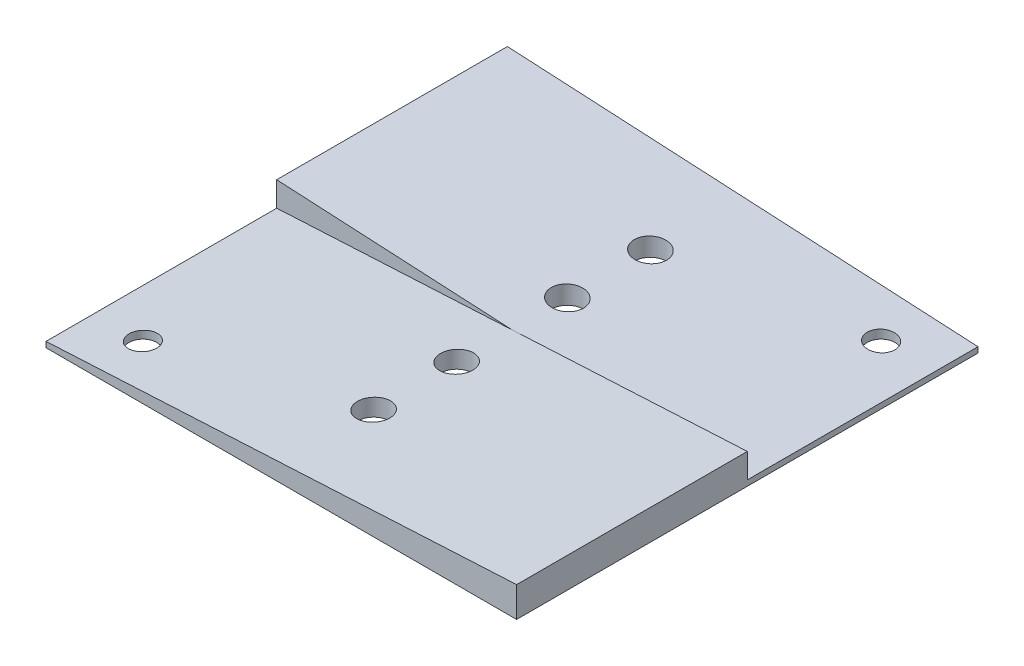
from build123d import *

# Parameters (mm, degrees)
ESBO_O2_W                  = 51
ESBO_O2_H                  = 50
RESSALTO_EXTRUS_O2_DEPTH   = 6
CORTE_EXTRUS_O1_DEPTH      = 25
CORTE_EXTRUS_O3_DEPTH      = 25
CORTE_EXTRUS_O5_DEPTH      = 36.860301149
CORTE_EXTRUS_O5_DEPTH_BACK = 36.860301149
ESBO_O5_R                  = 1.75
ESBO_O7_R                  = 1.5
CORTE_EXTRUS_O6_DEPTH      = 36.860301149


with BuildPart() as part:
    # Esboço2 → Ressalto-extrusão2 (new body)
    with BuildSketch(Plane(origin=(0, 0, 0), x_dir=(1, 0, 0), z_dir=(0, 1, 0))):
        Rectangle(ESBO_O2_W, ESBO_O2_H)
    extrude(amount=RESSALTO_EXTRUS_O2_DEPTH)

    # Esboço3 → Corte-extrusão1 (cut)
    with BuildSketch(Plane.XY.offset(25)):
        Polygon((-25.5, 0.6), (25.5, 3.272796743), (25.5, 6), (-25.5, 6), align=None)
    extrude(amount=-CORTE_EXTRUS_O1_DEPTH, mode=Mode.SUBTRACT)

    # Esboço4 → Corte-extrusão3 (cut)
    with BuildSketch(Plane(origin=(0, 0, -25), x_dir=(-1, 0, 0), z_dir=(0, 0, -1))):
        Polygon((-25.5, 0.6), (25.5, 3.272796743), (25.5, 6), (-25.5, 6), align=None)
    extrude(amount=-CORTE_EXTRUS_O3_DEPTH, mode=Mode.SUBTRACT)

    # Esboço5 → Corte-extrusão5 (cut, two sides: drawn at the far end of the back side and taken through both)
    with BuildSketch(Plane.XZ.offset(-CORTE_EXTRUS_O5_DEPTH_BACK)):
        with Locations((0, 6)):
            Circle(ESBO_O5_R)
        with Locations((0, 15)):
            Circle(ESBO_O5_R)
        with Locations((0, -15)):
            Circle(ESBO_O5_R)
        with Locations((0, -6)):
            Circle(ESBO_O5_R)
    extrude(amount=CORTE_EXTRUS_O5_DEPTH + CORTE_EXTRUS_O5_DEPTH_BACK, mode=Mode.SUBTRACT)

    # Esboço7 → Corte-extrusão6 (cut, through all)
    with BuildSketch(Plane.XZ):
        with Locations((-20, 20)):
            Circle(ESBO_O7_R)
        with Locations((20, -20)):
            Circle(ESBO_O7_R)
    extrude(amount=-CORTE_EXTRUS_O6_DEPTH, mode=Mode.SUBTRACT)


solid = part.part
